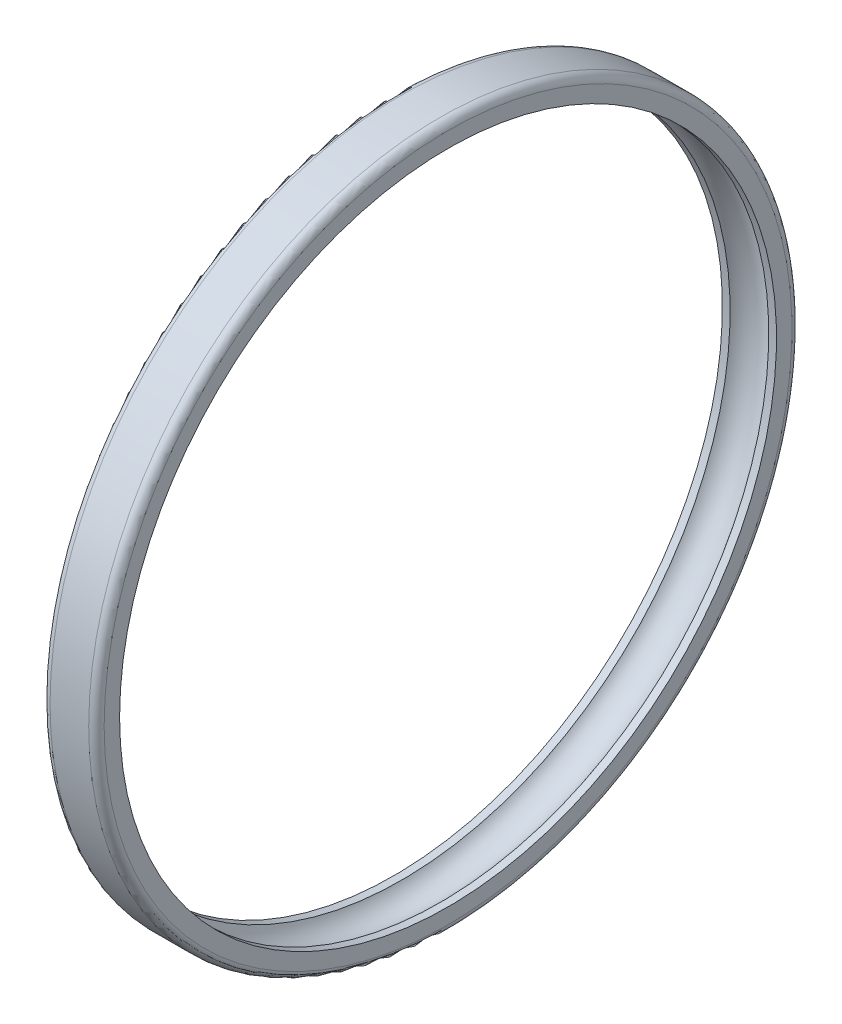
from build123d import *


with BuildPart() as part:
    # Sketch1 → Revolve1 (revolve)
    with BuildSketch(Plane.XY, mode=Mode.PRIVATE) as revolve1_sk:
        with BuildLine():
            Line((31.75, 539.75), (44.45, 539.75))
            Line((44.45, 539.75), (44.45, 565.15))
            ThreePointArc((44.45, 565.15), (40.730256121, 574.130256121), (31.75, 577.85))
            Line((31.75, 577.85), (-31.75, 577.85))
            ThreePointArc((-31.75, 577.85), (-40.730256121, 574.130256121), (-44.45, 565.15))
            Line((-44.45, 565.15), (-44.45, 539.75))
            Line((-44.45, 539.75), (-31.75, 539.75))
            ThreePointArc((-31.75, 539.75), (0, 556.789432581), (31.75, 539.75))
        make_face()
    revolve(revolve1_sk.sketch.rotate(Axis((-592.782331512, 0, 0), (1, 0, 0)), 90), axis=Axis((-592.782331512, 0, 0), (1, 0, 0)))


solid = part.part
